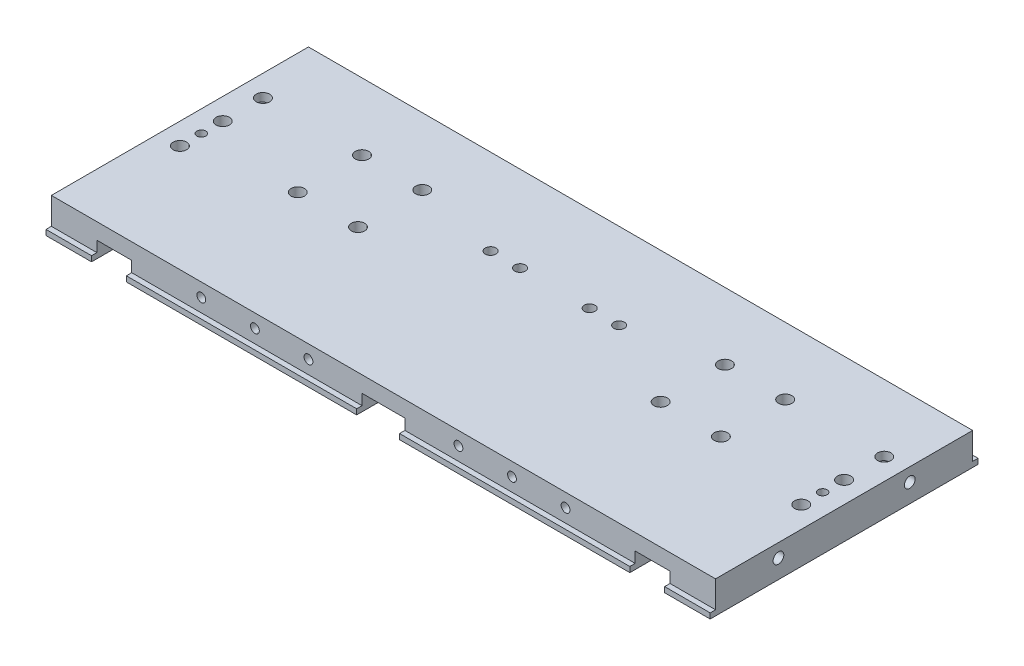
from build123d import *

# Parameters (mm, degrees)
AUFSATZ_LINEAR_AUSTRAGEN1_DEPTH    = 12
SKIZZE3_W                          = 248
SKIZZE3_H                          = 2
AUFSATZ_LINEAR_AUSTRAGEN2_DEPTH    = 2
SKIZZE4_W                          = 248
SKIZZE4_H                          = 2
AUFSATZ_LINEAR_AUSTRAGEN3_DEPTH    = 2
SKIZZE5_W                          = 13
SKIZZE5_H                          = 100
SKIZZE5_W_2                        = 16
SCHNITT_LINEAR_AUSTRAGEN1_DEPTH    = 6
M4_GEWINDEBOHRUNG1_D               = 3.3
M4_GEWINDEBOHRUNG1_DEPTH           = 20
M4_GEWINDEBOHRUNG1_TIP             = 0.991420021
M4_GEWINDEBOHRUNG1_ON_FACE_2_D     = 3.3
M4_GEWINDEBOHRUNG1_ON_FACE_2_DEPTH = 20
M4_GEWINDEBOHRUNG1_ON_FACE_2_TIP   = 0.991420021
F_4_0_4_DURCHMESSER_BOHRUNG1_D     = 4
F_4_0_4_DURCHMESSER_BOHRUNG1_DEPTH = 18
F_4_0_4_DURCHMESSER_BOHRUNG1_TIP   = 1.201721238
F_4_0_4_DURCHMESSER_BOHRUNG2_D     = 4
F_4_0_4_DURCHMESSER_BOHRUNG2_DEPTH = 18
F_4_0_4_DURCHMESSER_BOHRUNG2_TIP   = 1.201721238
M4_GEWINDEBOHRUNG2_D               = 3.3
SKIZZE15_R                         = 2
SCHNITT_LINEAR_AUSTRAGEN2_DEPTH    = 135.238593556
F_5_0_5_DURCHMESSER_BOHRUNG1_D     = 5


with BuildPart() as part:
    # Skizze2 → Aufsatz-Linear austragen1 (new body)
    with BuildSketch(Plane(origin=(0, 0, 0), x_dir=(1, 0, 0), z_dir=(0, 1, 0))):
        Polygon((124, 0), (0, 0), (-124, 0), (-124, -48), (124, -48), align=None)
        Polygon((-124, 0), (0, 0), (124, 0), (124, 48), (-124, 48), align=None)
    extrude(amount=AUFSATZ_LINEAR_AUSTRAGEN1_DEPTH)

    # Skizze3 → Aufsatz-Linear austragen2 (add)
    with BuildSketch(Plane.XY.offset(48)):
        with Locations((0, 1)):
            Rectangle(SKIZZE3_W, SKIZZE3_H)
    extrude(amount=AUFSATZ_LINEAR_AUSTRAGEN2_DEPTH)

    # Skizze4 → Aufsatz-Linear austragen3 (add)
    with BuildSketch(Plane(origin=(0, 0, -48), x_dir=(-1, 0, 0), z_dir=(0, 0, -1))):
        with Locations((0, 1)):
            Rectangle(SKIZZE4_W, SKIZZE4_H)
    extrude(amount=AUFSATZ_LINEAR_AUSTRAGEN3_DEPTH)

    # Skizze5 → Schnitt-Linear austragen1 (cut)
    with BuildSketch(Plane.XZ):
        with Locations((100.5, 0)):
            Rectangle(SKIZZE5_W, SKIZZE5_H)
        Rectangle(SKIZZE5_W_2, SKIZZE5_H)
        with Locations((-100.5, 0)):
            Rectangle(SKIZZE5_W, SKIZZE5_H)
    extrude(amount=-SCHNITT_LINEAR_AUSTRAGEN1_DEPTH, mode=Mode.SUBTRACT)

    # M4 Gewindebohrung1
    with Locations(Plane(origin=(68, 7, -48), x_dir=(-1, 0, 0), z_dir=(0, 0, -1))):
        with Locations((0, 0), (20, 0), (40, 0), (136, 0), (116, 0), (96, 0)):
            Hole(M4_GEWINDEBOHRUNG1_D / 2, depth=M4_GEWINDEBOHRUNG1_DEPTH)
            with Locations((0, 0, -(M4_GEWINDEBOHRUNG1_DEPTH + M4_GEWINDEBOHRUNG1_TIP / 2))):  # 118° drill point
                Cone(0, M4_GEWINDEBOHRUNG1_D / 2, M4_GEWINDEBOHRUNG1_TIP, mode=Mode.SUBTRACT)

    # M4 Gewindebohrung1 on face 2
    with Locations(Plane(origin=(-68, 7, 48), x_dir=(1, 0, 0), z_dir=(0, 0, 1))):
        with Locations((0, 0), (20, 0), (40, 0), (136, 0), (116, 0), (96, 0)):
            Hole(M4_GEWINDEBOHRUNG1_ON_FACE_2_D / 2, depth=M4_GEWINDEBOHRUNG1_ON_FACE_2_DEPTH)
            with Locations((0, 0, -(M4_GEWINDEBOHRUNG1_ON_FACE_2_DEPTH + M4_GEWINDEBOHRUNG1_ON_FACE_2_TIP / 2))):  # 118° drill point
                Cone(0, M4_GEWINDEBOHRUNG1_ON_FACE_2_D / 2, M4_GEWINDEBOHRUNG1_ON_FACE_2_TIP, mode=Mode.SUBTRACT)

    # Ø4.0 (4) Durchmesser Bohrung1
    with Locations(Plane(origin=(-124, 7, -24.5), x_dir=(0, 0, -1), z_dir=(-1, 0, 0))):
        with Locations((0, 0), (-49, 0)):
            Hole(F_4_0_4_DURCHMESSER_BOHRUNG1_D / 2, depth=F_4_0_4_DURCHMESSER_BOHRUNG1_DEPTH)
            with Locations((0, 0, -(F_4_0_4_DURCHMESSER_BOHRUNG1_DEPTH + F_4_0_4_DURCHMESSER_BOHRUNG1_TIP / 2))):  # 118° drill point
                Cone(0, F_4_0_4_DURCHMESSER_BOHRUNG1_D / 2, F_4_0_4_DURCHMESSER_BOHRUNG1_TIP, mode=Mode.SUBTRACT)

    # Ø4.0 (4) Durchmesser Bohrung2
    with Locations(Plane(origin=(124, 7, 24.5), x_dir=(0, 0, 1), z_dir=(1, 0, 0))):
        with Locations((0, 0), (-49, 0)):
            Hole(F_4_0_4_DURCHMESSER_BOHRUNG2_D / 2, depth=F_4_0_4_DURCHMESSER_BOHRUNG2_DEPTH)
            with Locations((0, 0, -(F_4_0_4_DURCHMESSER_BOHRUNG2_DEPTH + F_4_0_4_DURCHMESSER_BOHRUNG2_TIP / 2))):  # 118° drill point
                Cone(0, F_4_0_4_DURCHMESSER_BOHRUNG2_D / 2, F_4_0_4_DURCHMESSER_BOHRUNG2_TIP, mode=Mode.SUBTRACT)

    # M4 Gewindebohrung2 (through all)
    with Locations(Plane(origin=(-116, 12, 0), x_dir=(0, 0, 1), z_dir=(0, 1, 0))):
        with Locations((0, 0), (0, 232)):
            Hole(M4_GEWINDEBOHRUNG2_D / 2)

    # Skizze15 → Schnitt-Linear austragen2 (cut, through all)
    with BuildSketch(Plane(origin=(0, 12, 0), x_dir=(1, 0, 0), z_dir=(0, 1, 0))):
        with Locations(Location((24, 16, 0), (0, 0, 270))):
            Circle(SKIZZE15_R)
        with Locations(Location((-13, 16, 0), (0, 0, 270))):
            Circle(SKIZZE15_R)
        with Locations(Location((-24, 16, 0), (0, 0, 270))):
            Circle(SKIZZE15_R)
        with Locations(Location((13, 16, 0), (0, 0, 270))):
            Circle(SKIZZE15_R)
    extrude(amount=-SCHNITT_LINEAR_AUSTRAGEN2_DEPTH, mode=Mode.SUBTRACT)

    # Ø5.0 (5) Durchmesser Bohrung1 (through all)
    with Locations(Plane(origin=(-116, 12, -23), x_dir=(0, 0, 1), z_dir=(0, 1, 0))):
        with Locations((0, 0), (31, 0), (15, 0), (24, 37), (24, 59.5), (0, 59.5), (0, 37), (0, 195), (0, 172.5), (24, 172.5), (24, 195), (31, 232), (15, 232), (0, 232)):
            Hole(F_5_0_5_DURCHMESSER_BOHRUNG1_D / 2)


solid = part.part
